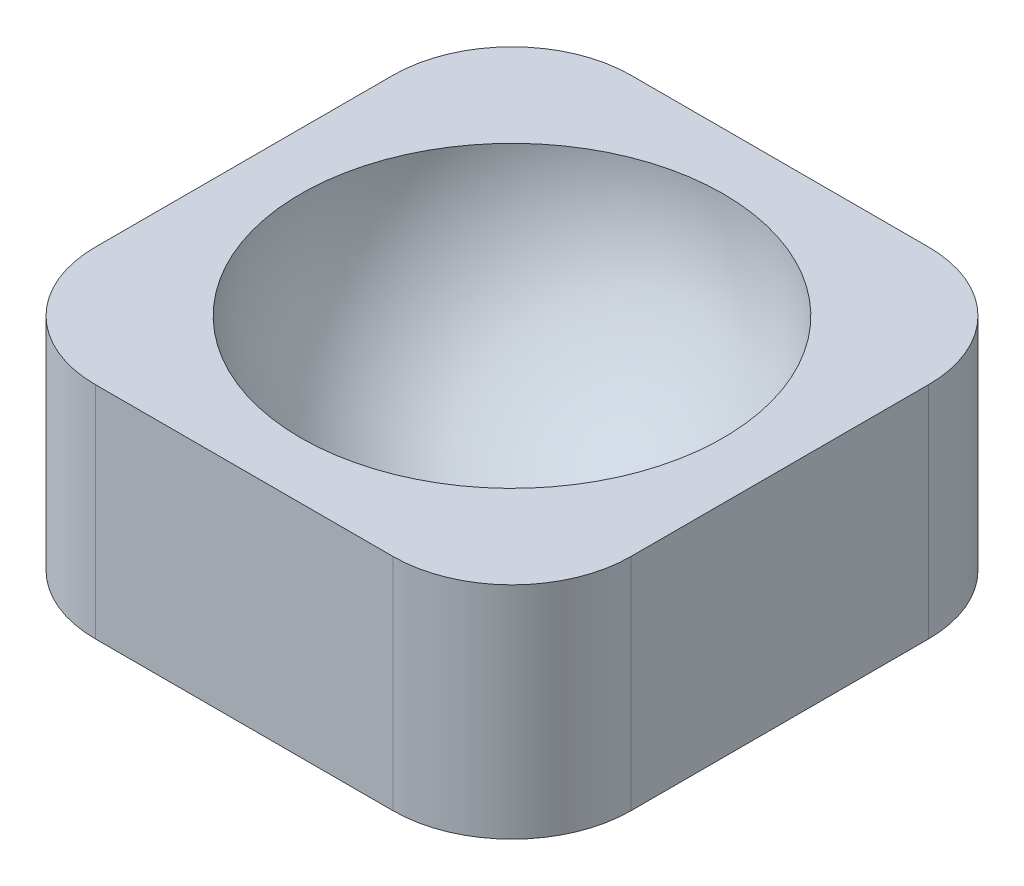
from build123d import *
from build123d.topology import SkipClean

# Parameters (mm, degrees)
SKETCH1_W           = 114.3
SKETCH1_H           = 114.3
SKETCH1_R           = 44.45
BOSS_EXTRUDE1_DEPTH = 46.99
CUT_REVOLVE1_ANGLE  = 180
FILLET1_R           = 25.4


with BuildPart() as part:
    # Sketch1 → Boss-Extrude1 (new body)
    # profile 1 of 2: a face of its own
    with BuildSketch(Plane(origin=(0, 0, 0), x_dir=(1, 0, 0), z_dir=(0, 1, 0))):
        with Locations((-57.15, 57.15)):
            Rectangle(SKETCH1_W, SKETCH1_H)
        with Locations((-57.15, 57.15)):
            Circle(SKETCH1_R, mode=Mode.SUBTRACT)
    # profile 2 of 2: a face of its own
    with BuildSketch(Plane(origin=(0, 0, 0), x_dir=(1, 0, 0), z_dir=(0, 1, 0))):
        with Locations((-57.15, 57.15)):
            Circle(SKETCH1_R)
    extrude(amount=BOSS_EXTRUDE1_DEPTH)

    # Sketch2 → Cut-Revolve1 (revolve, cut)
    with SkipClean():  # the faces are left unmerged after this step: merging them gives an invalid solid
        with BuildSketch(Plane(origin=(0, 46.99, 0), x_dir=(1, 0, 0), z_dir=(0, 1, 0))):
            with BuildLine():
                ThreePointArc((-12.065, 57.15), (-25.27009077, 89.02990923), (-57.15, 102.235))
                Line((-57.15, 102.235), (-57.15, 12.065))
                ThreePointArc((-57.15, 12.065), (-25.27009077, 25.27009077), (-12.065, 57.15))
            make_face()
            with BuildLine():
                Line((-57.15, 12.065), (-57.15, 102.235))
                ThreePointArc((-57.15, 102.235), (-102.235, 57.15), (-57.15, 12.065))
            make_face()
        revolve(axis=Axis((-57.15, 46.99, -114.3), (0, 0, 1)), revolution_arc=CUT_REVOLVE1_ANGLE, mode=Mode.SUBTRACT)

    # Fillet1
    fillet1_edges = [part.edges().sort_by_distance(p)[0] for p in [
        (-114.3, 23.495, -114.3),
        (0, 23.495, -114.3),
        (0, 23.495, 0),
        (-114.3, 23.495, 0),
    ]]
    fillet(fillet1_edges, radius=FILLET1_R)


solid = part.part
